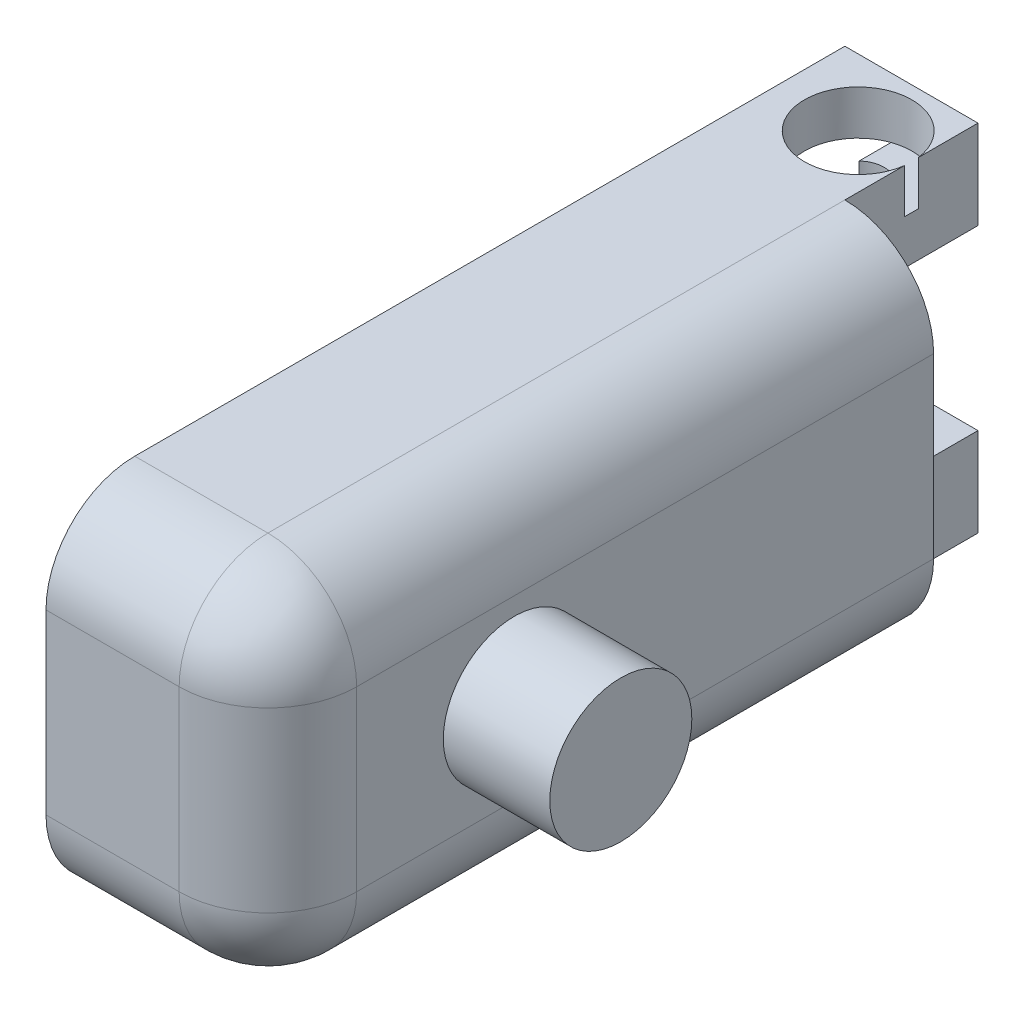
from build123d import *

# Parameters (mm, degrees)
SKETCH_1_W           = 25
SKETCH_1_H           = 37.5
EXTRUDE_1_DEPTH      = 20
FILLET_1_R           = 5
SKETCH_2_W           = 15
SKETCH_2_H           = 7.5
EXTRUDE_2_DEPTH      = 5
EXTRUDE_START        = -20
SKETCH_2_2_W         = 15
SKETCH_2_2_H         = 7.5
EXTRUDE_3_DEPTH      = 5
SKETCH_3_R           = 1.45
CUT_EXTRUDE_1_DEPTH  = 20
SKETCH_4_R           = 3.025
CUT_EXTRUDE_3_DEPTH  = 2.5
CUT_EXTRUDE_START    = -17.5
SKETCH_4_2_R         = 3.025
CUT_EXTRUDE_4_DEPTH  = 2.5
SKETCH_5_W           = 33
SKETCH_5_H           = 13
CUT_EXTRUDE_5_DEPTH  = 5.5
SKETCH_6_W           = 23
SKETCH_6_H           = 13
CUT_EXTRUDE_6_DEPTH  = 18.5
SKETCH_7_R           = 1.45
CUT_EXTRUDE_7_DEPTH  = 14.5
SKETCH_8_W           = 7
SKETCH_8_H           = 2.5
CUT_EXTRUDE_8_DEPTH  = 42.5
SKETCH_9_W           = 12
SKETCH_9_H           = 15
CUT_EXTRUDE_9_DEPTH  = 5
SKETCH_10_W          = 7
SKETCH_10_H          = 32.5
CUT_EXTRUDE_10_DEPTH = 1
CUT_EXTRUDE_START_2  = 15
SKETCH_10_2_W        = 7
SKETCH_10_2_H        = 32.5
CUT_EXTRUDE_11_DEPTH = 1
CUT_EXTRUDE_12_REACH = 40.332
SKETCH_11_R          = 3
SKETCH_12_R          = 4
EXTRUDE_4_DEPTH      = 6
SKETCH_13_W          = 15.131342966
SKETCH_13_H          = 46.669139603
CUT_EXTRUDE_13_DEPTH = 23


with BuildPart() as part:
    # Эскиз1 → Бобышка-Вытянуть1 (new body)
    with BuildSketch(Plane(origin=(0, 0, 0), x_dir=(1, 0, 0), z_dir=(0, 1, 0))):
        Rectangle(SKETCH_1_W, SKETCH_1_H)
    extrude(amount=EXTRUDE_1_DEPTH)

    # Скругление1
    fillet_1_edges = [part.edges().sort_by_distance(p)[0] for p in [
        (-12.5, 20, 0),
        (0, 20, 18.75),
        (12.5, 20, 0),
        (0, 0, 18.75),
        (-12.5, 0, 0),
        (12.5, 0, 0),
        (12.5, 10, 18.75),
        (-12.5, 10, 18.75),
    ]]
    fillet(fillet_1_edges, radius=FILLET_1_R)

    # Эскиз2 → Бобышка-Вытянуть2 (add)
    with BuildSketch(Plane(origin=(0, 20, 0), x_dir=(1, 0, 0), z_dir=(0, 1, 0))):
        with Locations((0, 22.5)):
            Rectangle(SKETCH_2_W, SKETCH_2_H)
    extrude(amount=-EXTRUDE_2_DEPTH)

    # Эскиз2<2> → Бобышка-Вытянуть3 (add)
    with BuildSketch(Plane(origin=(0, 20, 0), x_dir=(1, 0, 0), z_dir=(0, 1, 0)).offset(EXTRUDE_START)):
        with Locations((0, 22.5)):
            Rectangle(SKETCH_2_2_W, SKETCH_2_2_H)
    extrude(amount=EXTRUDE_3_DEPTH)

    # Эскиз3 → Вырез-Вытянуть1 (cut)
    with BuildSketch(Plane(origin=(0, 20, 0), x_dir=(1, 0, 0), z_dir=(0, 1, 0))):
        with Locations(Location((-4.5, 22.5, 0), (0, 0, 270))):
            Circle(SKETCH_3_R)
        with Locations(Location((4.5, 22.5, 0), (0, 0, 270))):
            Circle(SKETCH_3_R)
    extrude(amount=-CUT_EXTRUDE_1_DEPTH, mode=Mode.SUBTRACT)

    # Эскиз4 → Вырез-Вытянуть3 (cut)
    with BuildSketch(Plane(origin=(0, 20, 0), x_dir=(1, 0, 0), z_dir=(0, 1, 0))):
        with Locations((-4.5, 22.5)):
            Circle(SKETCH_4_R)
        with Locations((4.5, 22.5)):
            Circle(SKETCH_4_R)
    extrude(amount=-CUT_EXTRUDE_3_DEPTH, mode=Mode.SUBTRACT)

    # Эскиз4<2> → Вырез-Вытянуть4 (cut)
    with BuildSketch(Plane(origin=(0, 20, 0), x_dir=(1, 0, 0), z_dir=(0, 1, 0)).offset(CUT_EXTRUDE_START)):
        with Locations((-4.5, 22.5)):
            Circle(SKETCH_4_2_R)
        with Locations((4.5, 22.5)):
            Circle(SKETCH_4_2_R)
    extrude(amount=-CUT_EXTRUDE_4_DEPTH, mode=Mode.SUBTRACT)

    # Эскиз5 → Вырез-Вытянуть5 (cut)
    with BuildSketch(Plane.ZY.offset(12.5)):
        with Locations((-0.25, 10)):
            Rectangle(SKETCH_5_W, SKETCH_5_H)
    extrude(amount=-CUT_EXTRUDE_5_DEPTH, mode=Mode.SUBTRACT)

    # Эскиз6 → Вырез-Вытянуть6 (cut)
    with BuildSketch(Plane.ZY.offset(7)):
        with Locations((-0.25, 10)):
            Rectangle(SKETCH_6_W, SKETCH_6_H)
    extrude(amount=-CUT_EXTRUDE_6_DEPTH, mode=Mode.SUBTRACT)

    # Эскиз7 → Вырез-Вытянуть7 (cut)
    with BuildSketch(Plane.ZY.offset(7)):
        with Locations((-13.95, 10)):
            Circle(SKETCH_7_R)
        with Locations((13.45, 10)):
            Circle(SKETCH_7_R)
    extrude(amount=-CUT_EXTRUDE_7_DEPTH, mode=Mode.SUBTRACT)

    # Эскиз8 → Вырез-Вытянуть8 (cut)
    with BuildSketch(Plane(origin=(0, 0, -26.25), x_dir=(-1, 0, 0), z_dir=(0, 0, -1))):
        with Locations((0, 16.25)):
            Rectangle(SKETCH_8_W, SKETCH_8_H)
        with Locations((0, 3.75)):
            Rectangle(SKETCH_8_W, SKETCH_8_H)
    extrude(amount=-CUT_EXTRUDE_8_DEPTH, mode=Mode.SUBTRACT)

    # Эскиз9 → Вырез-Вытянуть9 (cut)
    with BuildSketch(Plane(origin=(0, 0, 11.25), x_dir=(-1, 0, 0), z_dir=(0, 0, -1))):
        with Locations((-2.5, 10)):
            Rectangle(SKETCH_9_W, SKETCH_9_H)
    extrude(amount=-CUT_EXTRUDE_9_DEPTH, mode=Mode.SUBTRACT)

    # Эскиз10 → Вырез-Вытянуть10 (cut)
    with BuildSketch(Plane.XZ.offset(-17.5)):
        Rectangle(SKETCH_10_W, SKETCH_10_H)
    extrude(amount=-CUT_EXTRUDE_10_DEPTH, mode=Mode.SUBTRACT)

    # Эскиз10<2> → Вырез-Вытянуть11 (cut)
    with BuildSketch(Plane.XZ.offset(-17.5).offset(CUT_EXTRUDE_START_2)):
        Rectangle(SKETCH_10_2_W, SKETCH_10_2_H)
    extrude(amount=CUT_EXTRUDE_11_DEPTH, mode=Mode.SUBTRACT)

    # Вырез-Вытянуть12: up to this face of the body (flat: up to its plane)
    cut_extrude_12_end = Plane(part.part.faces().sort_by_distance((-12.5, 10, -17.75))[0])
    # Эскиз11 → Вырез-Вытянуть12 (cut, up to the picked face)
    with BuildSketch(Plane.ZY.offset(7), mode=Mode.PRIVATE) as cut_extrude_12_sk1:
        with Locations((-13.95, 10)):
            Circle(SKETCH_11_R)
    cut_extrude_12_tool1 = split(extrude(cut_extrude_12_sk1.sketch, amount=CUT_EXTRUDE_12_REACH, mode=Mode.PRIVATE), bisect_by=cut_extrude_12_end, keep=Keep.BOTH, mode=Mode.PRIVATE)
    # Эскиз11 → Вырез-Вытянуть12 (cut, up to the picked face)
    with BuildSketch(Plane.ZY.offset(7), mode=Mode.PRIVATE) as cut_extrude_12_sk2:
        with Locations((13.45, 10)):
            Circle(SKETCH_11_R)
    cut_extrude_12_tool2 = split(extrude(cut_extrude_12_sk2.sketch, amount=CUT_EXTRUDE_12_REACH, mode=Mode.PRIVATE), bisect_by=cut_extrude_12_end, keep=Keep.BOTH, mode=Mode.PRIVATE)
    add(cut_extrude_12_tool1.solids().sort_by(Axis((-7, 10, -13.95), (-1, 0, 0)))[0], mode=Mode.SUBTRACT)
    add(cut_extrude_12_tool2.solids().sort_by(Axis((-7, 10, 13.45), (-1, 0, 0)))[0], mode=Mode.SUBTRACT)

    # Эскиз12 → Бобышка-Вытянуть4 (add)
    with BuildSketch(Plane(origin=(12.5, 0, 0), x_dir=(0, 0, -1), z_dir=(1, 0, 0))):
        with Locations(Location((-4.87, 10, 0), (0, 0, 180))):
            Circle(SKETCH_12_R)
    extrude(amount=EXTRUDE_4_DEPTH)

    # Эскиз13 → Вырез-Вытянуть13 (cut)
    with BuildSketch(Plane(origin=(0, 20, 0), x_dir=(1, 0, 0), z_dir=(0, 1, 0))):
        with Locations((-7.565671483, 2.915430198)):
            Rectangle(SKETCH_13_W, SKETCH_13_H)
    extrude(amount=-CUT_EXTRUDE_13_DEPTH, mode=Mode.SUBTRACT)


solid = part.part
